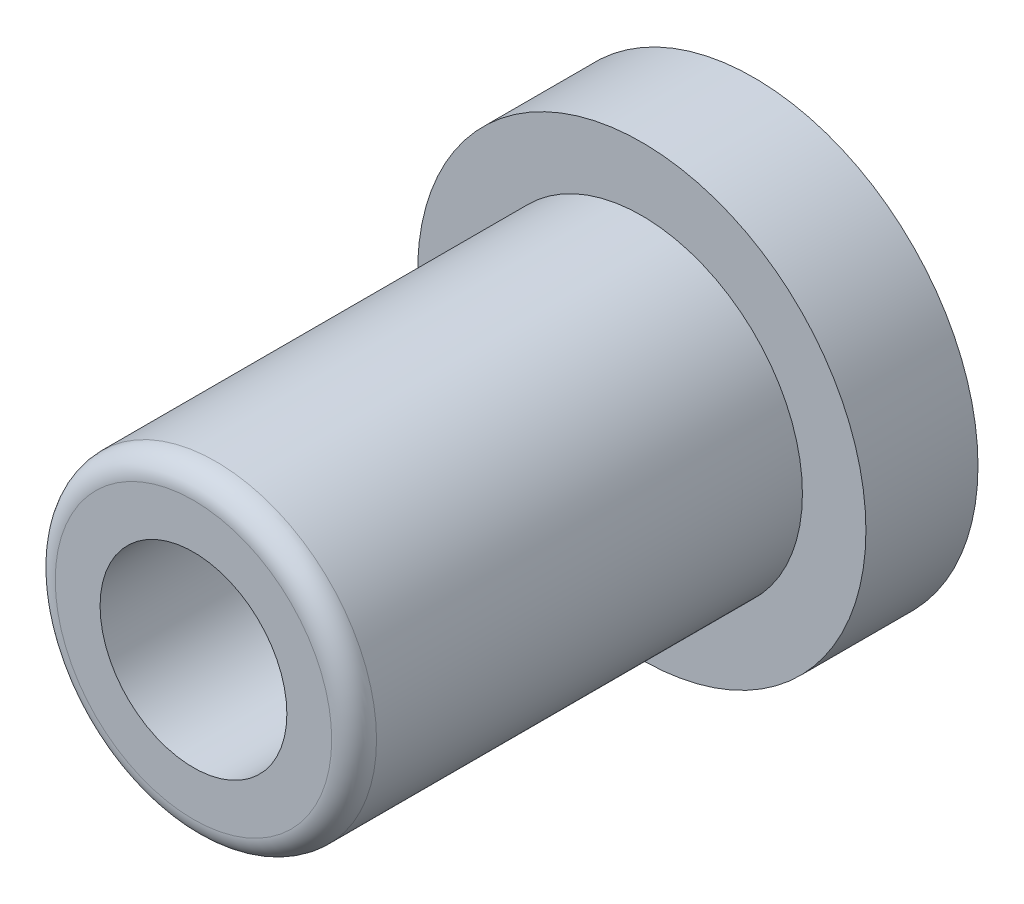
from build123d import *

# Parameters (mm, degrees)
ESBO_O1_R                                  = 3
RESSALTO_EXTRUS_O1_DEPTH                   = 1.5
ESBO_O2_R                                  = 2.15
RESSALTO_EXTRUS_O2_DEPTH                   = 6
BROCA_DE_ROSQUEAR_PARA_TARRAXA_DE_M3X0_5_D = 2.5
FILETE1_R                                  = 0.3


with BuildPart() as part:
    # Esboço1 → Ressalto-extrusão1 (new body)
    with BuildSketch(Plane.XY):
        with Locations((-15.341260315, 7.915210608)):
            Circle(ESBO_O1_R)
    extrude(amount=RESSALTO_EXTRUS_O1_DEPTH)

    # Esboço2 → Ressalto-extrusão2 (add)
    with BuildSketch(Plane.XY.offset(1.5)):
        with Locations((-15.341260315, 7.915210608)):
            Circle(ESBO_O2_R)
    extrude(amount=RESSALTO_EXTRUS_O2_DEPTH)

    # Broca de rosquear para tarraxa de M3x0.51 (through all)
    with Locations(Plane(origin=(0, 0, 0), x_dir=(-1, 0, 0), z_dir=(0, 0, -1))):
        with Locations((15.341260315, 7.915210608)):
            Hole(BROCA_DE_ROSQUEAR_PARA_TARRAXA_DE_M3X0_5_D / 2)

    # Filete1
    filete1_edges = [part.edges().sort_by_distance(p)[0] for p in [
        (-17.491260315, 7.915210608, 7.5),
    ]]
    fillet(filete1_edges, radius=FILETE1_R)


solid = part.part
